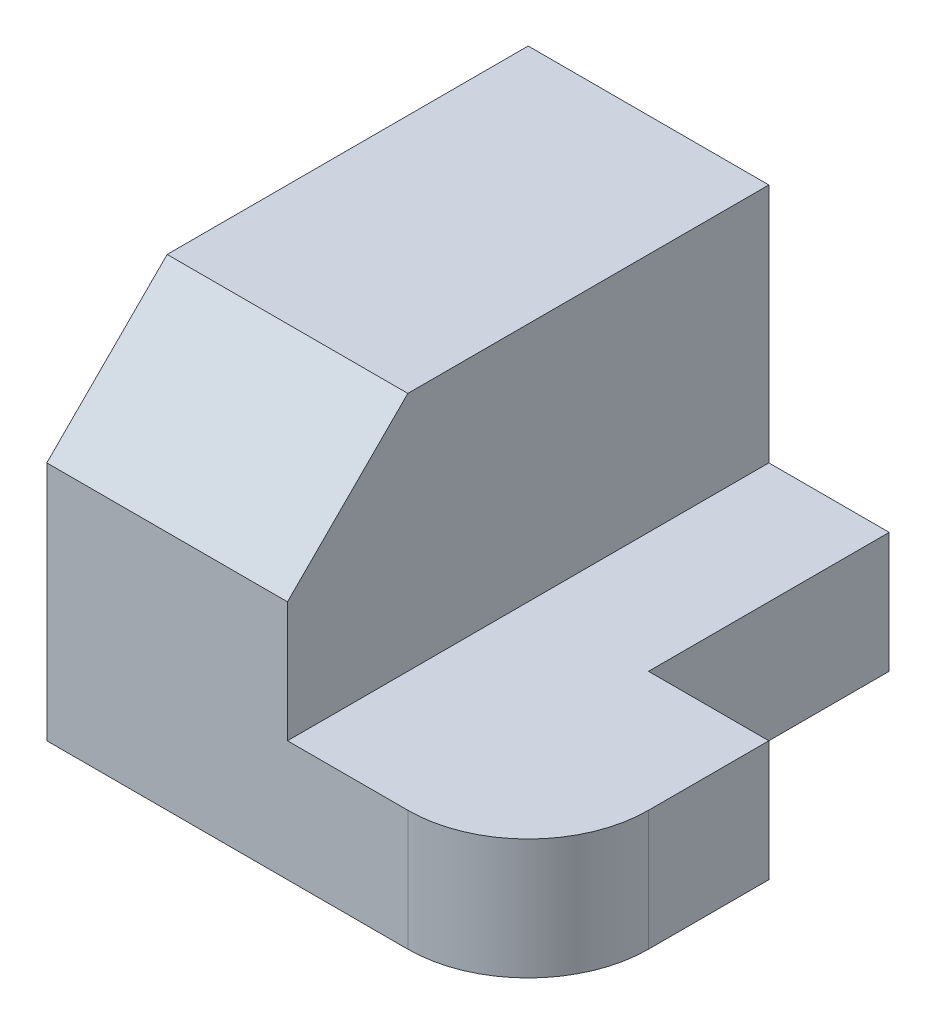
from build123d import *

# Parameters (mm, degrees)
BOSS_EXTRUDE1_DEPTH = 30
SKETCH3_OUTSIDE_W   = 54.806
SKETCH3_OUTSIDE_H   = 54.806
SKETCH3_OUTSIDE_W_2 = 20
SKETCH3_OUTSIDE_H_2 = 40
CUT_EXTRUDE1_DEPTH  = 20
CUT_EXTRUDE2_DEPTH  = 20


with BuildPart() as part:
    # Sketch2 → Boss-Extrude1 (new body)
    with BuildSketch(Plane(origin=(0, 0, 0), x_dir=(1, 0, 0), z_dir=(0, 1, 0))):
        with BuildLine():
            Line((-43.760683761, 14.358974359), (-43.760683761, -25.641025641))
            Line((-43.760683761, -25.641025641), (-13.760683761, -25.641025641))
            ThreePointArc((-13.760683761, -25.641025641), (-6.689615949, -22.712093453), (-3.760683761, -15.641025641))
            Line((-3.760683761, -15.641025641), (-3.760683761, -5.641025641))
            Line((-3.760683761, -5.641025641), (-13.760683761, -5.641025641))
            Line((-13.760683761, -5.641025641), (-13.760683761, 14.358974359))
            Line((-13.760683761, 14.358974359), (-43.760683761, 14.358974359))
        make_face()
    extrude(amount=BOSS_EXTRUDE1_DEPTH)

    # Sketch3 outside → Cut-Extrude1 (cut)
    with BuildSketch(Plane(origin=(0, 30, 0), x_dir=(1, 0, 0), z_dir=(0, 1, 0))):
        with Locations((-23.761, -5.641)):
            Rectangle(SKETCH3_OUTSIDE_W, SKETCH3_OUTSIDE_H)
        with Locations((-33.760683761, -5.641025641)):
            Rectangle(SKETCH3_OUTSIDE_W_2, SKETCH3_OUTSIDE_H_2, mode=Mode.SUBTRACT)
    extrude(amount=-CUT_EXTRUDE1_DEPTH, mode=Mode.SUBTRACT)

    # Sketch4 → Cut-Extrude2 (cut)
    with BuildSketch(Plane.ZY.offset(43.760683761)):
        Polygon((15.641025641, 30), (25.641025641, 20), (25.641025641, 30), align=None)
    extrude(amount=-CUT_EXTRUDE2_DEPTH, mode=Mode.SUBTRACT)


solid = part.part
